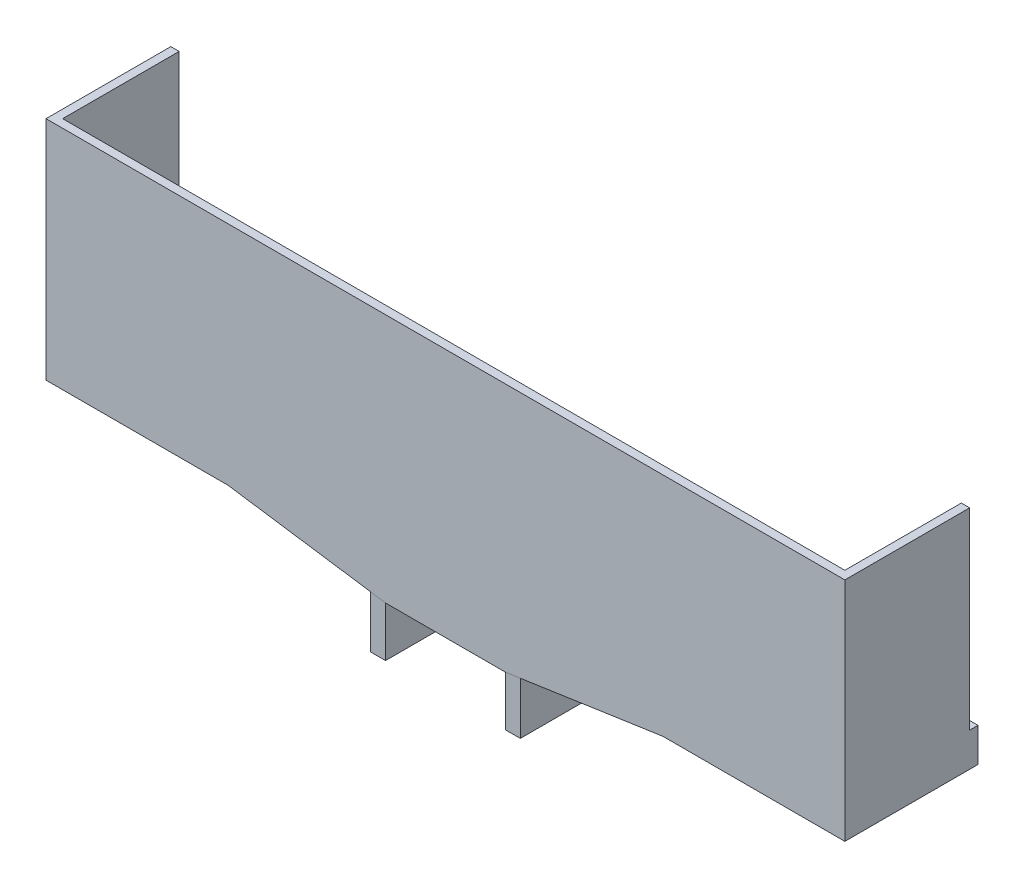
from build123d import *
from OCP.BRepFilletAPI import BRepFilletAPI_MakeChamfer

# Parameters (mm, degrees)
EXTRUDE_1_DEPTH             = 80
CUT_EXTRUDE_1_DEPTH         = 70
CUT_EXTRUDE_2_DEPTH         = 5
EXTRUDE_3_DEPTH             = 30
EXTRUDE_3_DIRECTION_2_REACH = 296.109
EXTRUDE_4_DEPTH             = 80
CHAMFER_1_SIZE              = 3
CHAMFER_1_SIZE2             = 3.555070402


with BuildPart() as part:
    # 草圖20 → 填料-伸長1 (new body)
    with BuildSketch(Plane.XY):
        Polygon((-36, 0), (-240, 30), (-240, 150), (240, 150), (240, 30), (36, 0), align=None)
    extrude(amount=EXTRUDE_1_DEPTH)

    # 草圖22 → 除料-伸長1 (cut)
    with BuildSketch(Plane.XY.offset(5)):
        Polygon((-235, 34.318482435), (-36, 5.053776552), (-36, 0), (36, 0), (36, 5.053776552), (235, 34.318482435), (235, 150), (-235, 150), align=None)
    extrude(amount=CUT_EXTRUDE_1_DEPTH, mode=Mode.SUBTRACT)

    # 草圖23 → 除料-伸長2 (cut)
    with BuildSketch(Plane(origin=(0, 0, 0), x_dir=(-1, 0, 0), z_dir=(0, 0, -1))):
        Polygon((-240, 34.318482435), (-235, 34.318482435), (-36, 5.053776552), (-36, 0), (36, 0), (36, 5.053776552), (235, 34.318482435), (240, 34.318482435), (240, 150), (-240, 150), align=None)
    extrude(amount=-CUT_EXTRUDE_2_DEPTH, mode=Mode.SUBTRACT)


with BuildPart() as body_2:
    # 草圖25 → 填料-伸長3 (new body)
    with BuildSketch(Plane.XZ):
        Polygon((-36, 80), (-45, 80), (-45, 40), (-36, 40), (-36, 75), align=None)
        Polygon((45, 40), (45, 80), (36, 80), (36, 75), (36, 40), align=None)
    extrude(amount=EXTRUDE_3_DEPTH)


    # 草圖25 → 填料-伸長3 direction 2 (add, up to next)
    with BuildSketch(Plane.XZ, mode=Mode.PRIVATE) as extrude_3_direction_2_sk1:
        Polygon((-36, 80), (-45, 80), (-45, 40), (-36, 40), (-36, 75), align=None)
    extrude_3_direction_2_tool1 = extrude(extrude_3_direction_2_sk1.sketch, amount=-EXTRUDE_3_DIRECTION_2_REACH, mode=Mode.PRIVATE) - part.part
    # 草圖25 → 填料-伸長3 direction 2 (add, up to next)
    with BuildSketch(Plane.XZ, mode=Mode.PRIVATE) as extrude_3_direction_2_sk2:
        Polygon((45, 40), (45, 80), (36, 80), (36, 75), (36, 40), align=None)
    extrude_3_direction_2_tool2 = extrude(extrude_3_direction_2_sk2.sketch, amount=-EXTRUDE_3_DIRECTION_2_REACH, mode=Mode.PRIVATE) - part.part
    add(extrude_3_direction_2_tool1.solids().sort_by_distance((-40.5, 0, 60))[0])
    add(extrude_3_direction_2_tool2.solids().sort_by_distance((40.5, 0, 60))[0])


with BuildPart() as part_1:
    add(part.part)

    # 草圖26 → 填料-伸長4 (add)
    with BuildSketch(Plane(origin=(0, 0, 0), x_dir=(-1, 0, 0), z_dir=(0, 0, -1))):
        Polygon((-130.69, 13.925), (-240, 13.925), (-240, 30), align=None)
        Polygon((240, 13.925), (240, 30), (130.69, 13.925), align=None)
    extrude(amount=-EXTRUDE_4_DEPTH)

    # 導角1: one chamfer whose edges measure the first distance from different faces: ONE call of the kernel's chamfer builder (chamfer() names one face for all edges)
    chamfer_1_edges_1 = [part_1.edges().sort_by_distance(p)[0] for p in [
        (36, 5.053776552, 37.5),
    ]]
    chamfer_1_side_1 = [part_1.faces().sort_by_distance(p)[0] for p in [
        (135.5, 19.686129493, 37.5),
    ]]
    chamfer_1_edges_2 = [part_1.edges().sort_by_distance(p)[0] for p in [
        (-36, 5.053776552, 37.5),
    ]]
    chamfer_1_side_2 = [part_1.faces().sort_by_distance(p)[0] for p in [
        (-36, 2.526888276, 37.5),
    ]]
    chamfer_1 = BRepFilletAPI_MakeChamfer(part_1.part.solid().wrapped)
    for e in chamfer_1_edges_1:
        chamfer_1.Add(CHAMFER_1_SIZE, CHAMFER_1_SIZE2, e.wrapped, chamfer_1_side_1[0].wrapped)  # the first distance lies on this face
    for e in chamfer_1_edges_2:
        chamfer_1.Add(CHAMFER_1_SIZE, CHAMFER_1_SIZE2, e.wrapped, chamfer_1_side_2[0].wrapped)  # the first distance lies on this face
    add(Compound.cast(chamfer_1.Shape()), mode=Mode.REPLACE)


solid = Compound([body_2.part, part_1.part])
